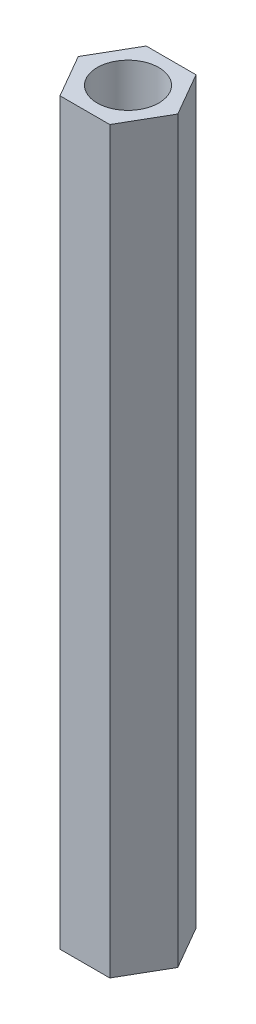
from build123d import *

# Parameters (mm, degrees)
SKETCH_1_R      = 2.5
EXTRUDE_1_DEPTH = 60


with BuildPart() as part:
    # 草图1 → 凸台-拉伸1 (new body)
    with BuildSketch(Plane(origin=(0, 0, 0), x_dir=(1, 0, 0), z_dir=(0, 1, 0))):
        Polygon((2.020725942, 3.5), (-2.020725942, 3.5), (-4.041451884, 0), (-2.020725942, -3.5), (2.020725942, -3.5), (4.041451884, 0), align=None)
        with Locations(Location((0, 0, 0), (0, 0, 270))):
            Circle(SKETCH_1_R, mode=Mode.SUBTRACT)
    extrude(amount=EXTRUDE_1_DEPTH)


solid = part.part
